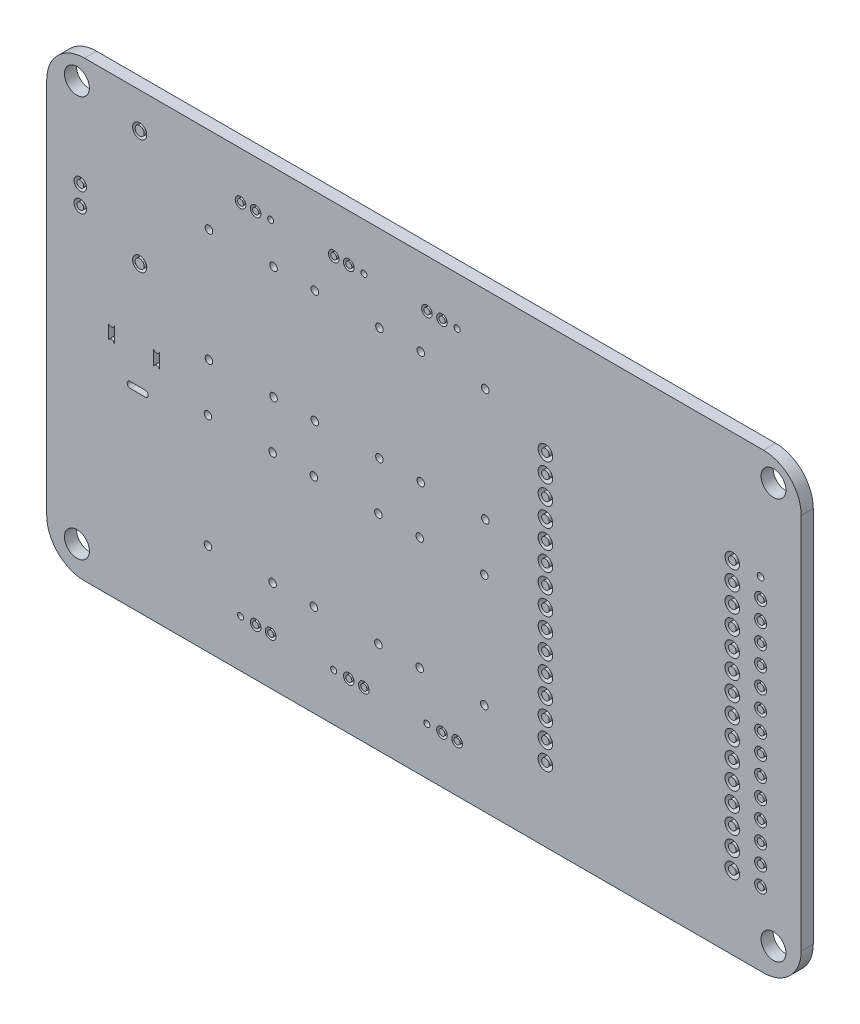
from build123d import *

# Parameters (mm, degrees)
BOSS_EXTRUDE2_DEPTH = 1.6
MULTI_LAYER_R       = 0.93980188
MULTI_LAYER_R_2     = 0.599441199
MULTI_LAYER_R_3     = 0.825501651
MULTI_LAYER_R_4     = 0.4500127
MULTI_LAYER_R_5     = 0.96520193
MULTI_LAYER_R_6     = 0.787401575
MULTI_LAYER_R_7     = 0.444500889
MULTI_LAYER_R_8     = 0.7
MULTI_LAYER_R_9     = 0.4
MULTI_LAYER_R_10    = 0.5
MULTI_LAYER_R_11    = 1.6500127
CUT_EXTRUDE2_DEPTH  = 1.6


with BuildPart() as part:
    # BoardOutLine → Boss-Extrude2 (new body)
    with BuildSketch(Plane.XY):
        with BuildLine():
            Line((0, -55), (0, -5))
            ThreePointArc((0, -5), (1.464466094, -1.464466094), (5, 0))
            Line((5, 0), (95, 0))
            ThreePointArc((95, 0), (98.535533906, -1.464466094), (100, -5))
            Line((100, -5), (100, -55))
            ThreePointArc((100, -55), (98.535533906, -58.535533906), (95, -60))
            Line((95, -60), (5, -60))
            ThreePointArc((5, -60), (1.464466094, -58.535533906), (0, -55))
        make_face()
    extrude(amount=BOSS_EXTRUDE2_DEPTH)

    # Multi-Layer → Cut-Extrude2 (cut)
    # profile 1 of 98: a face of its own
    with BuildSketch(Plane.XY.offset(1.6)):
        with Locations((12.319024638, -4.699009398)):
            Circle(MULTI_LAYER_R)
        with Locations((12.319024638, -4.699009398)):
            Circle(MULTI_LAYER_R_2, mode=Mode.SUBTRACT)
    # profile 2 of 98: a face of its own
    with BuildSketch(Plane.XY.offset(1.6)):
        with Locations((12.319024638, -19.939039878)):
            Circle(MULTI_LAYER_R)
        with Locations((12.319024638, -19.939039878)):
            Circle(MULTI_LAYER_R_2, mode=Mode.SUBTRACT)
    # profile 3 of 98: a face of its own
    with BuildSketch(Plane.XY.offset(1.6)):
        with Locations((4.44500889, -14.732029464)):
            Circle(MULTI_LAYER_R_3)
        with Locations((4.44500889, -14.732029464)):
            Circle(MULTI_LAYER_R_4, mode=Mode.SUBTRACT)
    # profile 4 of 98: a face of its own
    with BuildSketch(Plane.XY.offset(1.6)):
        with Locations((4.44500889, -17.272034544)):
            Circle(MULTI_LAYER_R_3)
        with Locations((4.44500889, -17.272034544)):
            Circle(MULTI_LAYER_R_4, mode=Mode.SUBTRACT)
    # profile 5 of 98: a face of its own
    with BuildSketch(Plane.XY.offset(1.6)):
        with Locations((90.864109728, -50.308356617)):
            Circle(MULTI_LAYER_R_5)
        with BuildLine():
            ThreePointArc((90.364109728, -50.308102616), (90.863982728, -50.808229616), (91.363855728, -50.308102616))
            ThreePointArc((91.363855728, -50.308102616), (90.863982728, -49.808229616), (90.364109728, -50.308102616))
        make_face(mode=Mode.SUBTRACT)
    # profile 6 of 98: a face of its own
    with BuildSketch(Plane.XY.offset(1.6)):
        with Locations((90.864109728, -47.768351537)):
            Circle(MULTI_LAYER_R_5)
        with BuildLine():
            ThreePointArc((90.364109728, -47.768097536), (90.863982728, -48.268224536), (91.363855728, -47.768097536))
            ThreePointArc((91.363855728, -47.768097536), (90.863982728, -47.268224536), (90.364109728, -47.768097536))
        make_face(mode=Mode.SUBTRACT)
    # profile 7 of 98: a face of its own
    with BuildSketch(Plane.XY.offset(1.6)):
        with Locations((90.864109728, -45.228346457)):
            Circle(MULTI_LAYER_R_5)
        with BuildLine():
            ThreePointArc((90.364109728, -45.228092456), (90.863982728, -45.728219456), (91.363855728, -45.228092456))
            ThreePointArc((91.363855728, -45.228092456), (90.863982728, -44.728219456), (90.364109728, -45.228092456))
        make_face(mode=Mode.SUBTRACT)
    # profile 8 of 98: a face of its own
    with BuildSketch(Plane.XY.offset(1.6)):
        with Locations((90.864109728, -42.688341377)):
            Circle(MULTI_LAYER_R_5)
        with BuildLine():
            ThreePointArc((90.364109728, -42.688087376), (90.863982728, -43.188214376), (91.363855728, -42.688087376))
            ThreePointArc((91.363855728, -42.688087376), (90.863982728, -42.188214376), (90.364109728, -42.688087376))
        make_face(mode=Mode.SUBTRACT)
    # profile 9 of 98: a face of its own
    with BuildSketch(Plane.XY.offset(1.6)):
        with Locations((90.864109728, -40.148336297)):
            Circle(MULTI_LAYER_R_5)
        with BuildLine():
            ThreePointArc((90.364109728, -40.148082296), (90.863982728, -40.648209296), (91.363855728, -40.148082296))
            ThreePointArc((91.363855728, -40.148082296), (90.863982728, -39.648209296), (90.364109728, -40.148082296))
        make_face(mode=Mode.SUBTRACT)
    # profile 10 of 98: a face of its own
    with BuildSketch(Plane.XY.offset(1.6)):
        with Locations((90.864109728, -37.608331217)):
            Circle(MULTI_LAYER_R_5)
        with BuildLine():
            ThreePointArc((90.364109728, -37.608077216), (90.863982728, -38.108204216), (91.363855728, -37.608077216))
            ThreePointArc((91.363855728, -37.608077216), (90.863982728, -37.108204216), (90.364109728, -37.608077216))
        make_face(mode=Mode.SUBTRACT)
    # profile 11 of 98: a face of its own
    with BuildSketch(Plane.XY.offset(1.6)):
        with Locations((90.864109728, -35.068326137)):
            Circle(MULTI_LAYER_R_5)
        with BuildLine():
            ThreePointArc((90.364109728, -35.068072136), (90.863982728, -35.568199136), (91.363855728, -35.068072136))
            ThreePointArc((91.363855728, -35.068072136), (90.863982728, -34.568199136), (90.364109728, -35.068072136))
        make_face(mode=Mode.SUBTRACT)
    # profile 12 of 98: a face of its own
    with BuildSketch(Plane.XY.offset(1.6)):
        with Locations((90.864109728, -32.528321057)):
            Circle(MULTI_LAYER_R_5)
        with BuildLine():
            ThreePointArc((90.364109728, -32.528067056), (90.863982728, -33.028194056), (91.363855728, -32.528067056))
            ThreePointArc((91.363855728, -32.528067056), (90.863982728, -32.028194056), (90.364109728, -32.528067056))
        make_face(mode=Mode.SUBTRACT)
    # profile 13 of 98: a face of its own
    with BuildSketch(Plane.XY.offset(1.6)):
        with Locations((90.864109728, -29.988315977)):
            Circle(MULTI_LAYER_R_5)
        with BuildLine():
            ThreePointArc((90.364109728, -29.988061976), (90.863982728, -30.488188976), (91.363855728, -29.988061976))
            ThreePointArc((91.363855728, -29.988061976), (90.863982728, -29.488188976), (90.364109728, -29.988061976))
        make_face(mode=Mode.SUBTRACT)
    # profile 14 of 98: a face of its own
    with BuildSketch(Plane.XY.offset(1.6)):
        with Locations((90.864109728, -27.448310897)):
            Circle(MULTI_LAYER_R_5)
        with BuildLine():
            ThreePointArc((90.364109728, -27.448056896), (90.863982728, -27.948183896), (91.363855728, -27.448056896))
            ThreePointArc((91.363855728, -27.448056896), (90.863982728, -26.948183896), (90.364109728, -27.448056896))
        make_face(mode=Mode.SUBTRACT)
    # profile 15 of 98: a face of its own
    with BuildSketch(Plane.XY.offset(1.6)):
        with Locations((90.864109728, -24.908305817)):
            Circle(MULTI_LAYER_R_5)
        with BuildLine():
            ThreePointArc((90.364109728, -24.908051816), (90.863982728, -25.408178816), (91.363855728, -24.908051816))
            ThreePointArc((91.363855728, -24.908051816), (90.863982728, -24.408178816), (90.364109728, -24.908051816))
        make_face(mode=Mode.SUBTRACT)
    # profile 16 of 98: a face of its own
    with BuildSketch(Plane.XY.offset(1.6)):
        with Locations((90.864109728, -22.368300737)):
            Circle(MULTI_LAYER_R_5)
        with BuildLine():
            ThreePointArc((90.364109728, -22.368046736), (90.863982728, -22.868173736), (91.363855728, -22.368046736))
            ThreePointArc((91.363855728, -22.368046736), (90.863982728, -21.868173736), (90.364109728, -22.368046736))
        make_face(mode=Mode.SUBTRACT)
    # profile 17 of 98: a face of its own
    with BuildSketch(Plane.XY.offset(1.6)):
        with Locations((90.864109728, -19.828295657)):
            Circle(MULTI_LAYER_R_5)
        with BuildLine():
            ThreePointArc((90.364109728, -19.828041656), (90.863982728, -20.328168656), (91.363855728, -19.828041656))
            ThreePointArc((91.363855728, -19.828041656), (90.863982728, -19.328168656), (90.364109728, -19.828041656))
        make_face(mode=Mode.SUBTRACT)
    # profile 18 of 98: a face of its own
    with BuildSketch(Plane.XY.offset(1.6)):
        with Locations((90.864109728, -17.288290577)):
            Circle(MULTI_LAYER_R_5)
        with BuildLine():
            ThreePointArc((90.364109728, -17.288036576), (90.863982728, -17.788163576), (91.363855728, -17.288036576))
            ThreePointArc((91.363855728, -17.288036576), (90.863982728, -16.788163576), (90.364109728, -17.288036576))
        make_face(mode=Mode.SUBTRACT)
    # profile 19 of 98: a face of its own
    with BuildSketch(Plane.XY.offset(1.6)):
        with Locations((90.864109728, -14.748285497)):
            Circle(MULTI_LAYER_R_5)
        with BuildLine():
            ThreePointArc((90.364109728, -14.748031496), (90.863982728, -15.248158496), (91.363855728, -14.748031496))
            ThreePointArc((91.363855728, -14.748031496), (90.863982728, -14.248158496), (90.364109728, -14.748031496))
        make_face(mode=Mode.SUBTRACT)
    # profile 20 of 98: a face of its own
    with BuildSketch(Plane.XY.offset(1.6)):
        with Locations((66.093980188, -14.748285497)):
            Circle(MULTI_LAYER_R_5)
        with BuildLine():
            ThreePointArc((65.593980188, -14.748031496), (66.093853188, -15.248158496), (66.593726187, -14.748031496))
            ThreePointArc((66.593726187, -14.748031496), (66.093853188, -14.248158496), (65.593980188, -14.748031496))
        make_face(mode=Mode.SUBTRACT)
    # profile 21 of 98: a face of its own
    with BuildSketch(Plane.XY.offset(1.6)):
        with Locations((66.093980188, -17.288290577)):
            Circle(MULTI_LAYER_R_5)
        with BuildLine():
            ThreePointArc((65.593980188, -17.288036576), (66.093853188, -17.788163576), (66.593726187, -17.288036576))
            ThreePointArc((66.593726187, -17.288036576), (66.093853188, -16.788163576), (65.593980188, -17.288036576))
        make_face(mode=Mode.SUBTRACT)
    # profile 22 of 98: a face of its own
    with BuildSketch(Plane.XY.offset(1.6)):
        with Locations((66.093980188, -19.828295657)):
            Circle(MULTI_LAYER_R_5)
        with BuildLine():
            ThreePointArc((65.593980188, -19.828041656), (66.093853188, -20.328168656), (66.593726187, -19.828041656))
            ThreePointArc((66.593726187, -19.828041656), (66.093853188, -19.328168656), (65.593980188, -19.828041656))
        make_face(mode=Mode.SUBTRACT)
    # profile 23 of 98: a face of its own
    with BuildSketch(Plane.XY.offset(1.6)):
        with Locations((66.093980188, -22.368300737)):
            Circle(MULTI_LAYER_R_5)
        with BuildLine():
            ThreePointArc((65.593980188, -22.368046736), (66.093853188, -22.868173736), (66.593726187, -22.368046736))
            ThreePointArc((66.593726187, -22.368046736), (66.093853188, -21.868173736), (65.593980188, -22.368046736))
        make_face(mode=Mode.SUBTRACT)
    # profile 24 of 98: a face of its own
    with BuildSketch(Plane.XY.offset(1.6)):
        with Locations((66.093980188, -24.908305817)):
            Circle(MULTI_LAYER_R_5)
        with BuildLine():
            ThreePointArc((65.593980188, -24.908051816), (66.093853188, -25.408178816), (66.593726187, -24.908051816))
            ThreePointArc((66.593726187, -24.908051816), (66.093853188, -24.408178816), (65.593980188, -24.908051816))
        make_face(mode=Mode.SUBTRACT)
    # profile 25 of 98: a face of its own
    with BuildSketch(Plane.XY.offset(1.6)):
        with Locations((66.093980188, -27.448310897)):
            Circle(MULTI_LAYER_R_5)
        with BuildLine():
            ThreePointArc((65.593980188, -27.448056896), (66.093853188, -27.948183896), (66.593726187, -27.448056896))
            ThreePointArc((66.593726187, -27.448056896), (66.093853188, -26.948183896), (65.593980188, -27.448056896))
        make_face(mode=Mode.SUBTRACT)
    # profile 26 of 98: a face of its own
    with BuildSketch(Plane.XY.offset(1.6)):
        with Locations((66.093980188, -29.988315977)):
            Circle(MULTI_LAYER_R_5)
        with BuildLine():
            ThreePointArc((65.593980188, -29.988061976), (66.093853188, -30.488188976), (66.593726187, -29.988061976))
            ThreePointArc((66.593726187, -29.988061976), (66.093853188, -29.488188976), (65.593980188, -29.988061976))
        make_face(mode=Mode.SUBTRACT)
    # profile 27 of 98: a face of its own
    with BuildSketch(Plane.XY.offset(1.6)):
        with Locations((66.093980188, -32.528321057)):
            Circle(MULTI_LAYER_R_5)
        with BuildLine():
            ThreePointArc((65.593980188, -32.528067056), (66.093853188, -33.028194056), (66.593726187, -32.528067056))
            ThreePointArc((66.593726187, -32.528067056), (66.093853188, -32.028194056), (65.593980188, -32.528067056))
        make_face(mode=Mode.SUBTRACT)
    # profile 28 of 98: a face of its own
    with BuildSketch(Plane.XY.offset(1.6)):
        with Locations((66.093980188, -35.068326137)):
            Circle(MULTI_LAYER_R_5)
        with BuildLine():
            ThreePointArc((65.593980188, -35.068072136), (66.093853188, -35.568199136), (66.593726187, -35.068072136))
            ThreePointArc((66.593726187, -35.068072136), (66.093853188, -34.568199136), (65.593980188, -35.068072136))
        make_face(mode=Mode.SUBTRACT)
    # profile 29 of 98: a face of its own
    with BuildSketch(Plane.XY.offset(1.6)):
        with Locations((66.093980188, -37.608331217)):
            Circle(MULTI_LAYER_R_5)
        with BuildLine():
            ThreePointArc((65.593980188, -37.608077216), (66.093853188, -38.108204216), (66.593726187, -37.608077216))
            ThreePointArc((66.593726187, -37.608077216), (66.093853188, -37.108204216), (65.593980188, -37.608077216))
        make_face(mode=Mode.SUBTRACT)
    # profile 30 of 98: a face of its own
    with BuildSketch(Plane.XY.offset(1.6)):
        with Locations((66.093980188, -40.148336297)):
            Circle(MULTI_LAYER_R_5)
        with BuildLine():
            ThreePointArc((65.593980188, -40.148082296), (66.093853188, -40.648209296), (66.593726187, -40.148082296))
            ThreePointArc((66.593726187, -40.148082296), (66.093853188, -39.648209296), (65.593980188, -40.148082296))
        make_face(mode=Mode.SUBTRACT)
    # profile 31 of 98: a face of its own
    with BuildSketch(Plane.XY.offset(1.6)):
        with Locations((66.093980188, -42.688341377)):
            Circle(MULTI_LAYER_R_5)
        with BuildLine():
            ThreePointArc((65.593980188, -42.688087376), (66.093853188, -43.188214376), (66.593726187, -42.688087376))
            ThreePointArc((66.593726187, -42.688087376), (66.093853188, -42.188214376), (65.593980188, -42.688087376))
        make_face(mode=Mode.SUBTRACT)
    # profile 32 of 98: a face of its own
    with BuildSketch(Plane.XY.offset(1.6)):
        with Locations((66.093980188, -45.228346457)):
            Circle(MULTI_LAYER_R_5)
        with BuildLine():
            ThreePointArc((65.593980188, -45.228092456), (66.093853188, -45.728219456), (66.593726187, -45.228092456))
            ThreePointArc((66.593726187, -45.228092456), (66.093853188, -44.728219456), (65.593980188, -45.228092456))
        make_face(mode=Mode.SUBTRACT)
    # profile 33 of 98: a face of its own
    with BuildSketch(Plane.XY.offset(1.6)):
        with Locations((66.093980188, -47.768351537)):
            Circle(MULTI_LAYER_R_5)
        with BuildLine():
            ThreePointArc((65.593980188, -47.768097536), (66.093853188, -48.268224536), (66.593726187, -47.768097536))
            ThreePointArc((66.593726187, -47.768097536), (66.093853188, -47.268224536), (65.593980188, -47.768097536))
        make_face(mode=Mode.SUBTRACT)
    # profile 34 of 98: a face of its own
    with BuildSketch(Plane.XY.offset(1.6)):
        with Locations((66.093980188, -50.308356617)):
            Circle(MULTI_LAYER_R_5)
        with BuildLine():
            ThreePointArc((65.593980188, -50.308102616), (66.093853188, -50.808229616), (66.593726187, -50.308102616))
            ThreePointArc((66.593726187, -50.308102616), (66.093853188, -49.808229616), (65.593980188, -50.308102616))
        make_face(mode=Mode.SUBTRACT)
    # profile 35 of 98: a face of its own
    with BuildSketch(Plane.XY.offset(1.6)):
        with Locations((94.61518923, -50.292100584)):
            Circle(MULTI_LAYER_R_6)
        with Locations((94.61518923, -50.292100584)):
            Circle(MULTI_LAYER_R_7, mode=Mode.SUBTRACT)
    # profile 36 of 98: a face of its own
    with BuildSketch(Plane.XY.offset(1.6)):
        with Locations((94.61518923, -47.752095504)):
            Circle(MULTI_LAYER_R_6)
        with Locations((94.61518923, -47.752095504)):
            Circle(MULTI_LAYER_R_7, mode=Mode.SUBTRACT)
    # profile 37 of 98: a face of its own
    with BuildSketch(Plane.XY.offset(1.6)):
        with Locations((94.61518923, -45.212090424)):
            Circle(MULTI_LAYER_R_6)
        with Locations((94.61518923, -45.212090424)):
            Circle(MULTI_LAYER_R_7, mode=Mode.SUBTRACT)
    # profile 38 of 98: a face of its own
    with BuildSketch(Plane.XY.offset(1.6)):
        with Locations((94.61518923, -42.672085344)):
            Circle(MULTI_LAYER_R_6)
        with Locations((94.61518923, -42.672085344)):
            Circle(MULTI_LAYER_R_7, mode=Mode.SUBTRACT)
    # profile 39 of 98: a face of its own
    with BuildSketch(Plane.XY.offset(1.6)):
        with Locations((94.61518923, -40.132080264)):
            Circle(MULTI_LAYER_R_6)
        with Locations((94.61518923, -40.132080264)):
            Circle(MULTI_LAYER_R_7, mode=Mode.SUBTRACT)
    # profile 40 of 98: a face of its own
    with BuildSketch(Plane.XY.offset(1.6)):
        with Locations((94.61518923, -37.592075184)):
            Circle(MULTI_LAYER_R_6)
        with Locations((94.61518923, -37.592075184)):
            Circle(MULTI_LAYER_R_7, mode=Mode.SUBTRACT)
    # profile 41 of 98: a face of its own
    with BuildSketch(Plane.XY.offset(1.6)):
        with Locations((94.61518923, -35.052070104)):
            Circle(MULTI_LAYER_R_6)
        with Locations((94.61518923, -35.052070104)):
            Circle(MULTI_LAYER_R_7, mode=Mode.SUBTRACT)
    # profile 42 of 98: a face of its own
    with BuildSketch(Plane.XY.offset(1.6)):
        with Locations((94.61518923, -32.512065024)):
            Circle(MULTI_LAYER_R_6)
        with Locations((94.61518923, -32.512065024)):
            Circle(MULTI_LAYER_R_7, mode=Mode.SUBTRACT)
    # profile 43 of 98: a face of its own
    with BuildSketch(Plane.XY.offset(1.6)):
        with Locations((94.61518923, -29.972059944)):
            Circle(MULTI_LAYER_R_6)
        with Locations((94.61518923, -29.972059944)):
            Circle(MULTI_LAYER_R_7, mode=Mode.SUBTRACT)
    # profile 44 of 98: a face of its own
    with BuildSketch(Plane.XY.offset(1.6)):
        with Locations((94.61518923, -27.432054864)):
            Circle(MULTI_LAYER_R_6)
        with Locations((94.61518923, -27.432054864)):
            Circle(MULTI_LAYER_R_7, mode=Mode.SUBTRACT)
    # profile 45 of 98: a face of its own
    with BuildSketch(Plane.XY.offset(1.6)):
        with Locations((94.61518923, -24.892049784)):
            Circle(MULTI_LAYER_R_6)
        with Locations((94.61518923, -24.892049784)):
            Circle(MULTI_LAYER_R_7, mode=Mode.SUBTRACT)
    # profile 46 of 98: a face of its own
    with BuildSketch(Plane.XY.offset(1.6)):
        with Locations((94.61518923, -22.352044704)):
            Circle(MULTI_LAYER_R_6)
        with Locations((94.61518923, -22.352044704)):
            Circle(MULTI_LAYER_R_7, mode=Mode.SUBTRACT)
    # profile 47 of 98: a face of its own
    with BuildSketch(Plane.XY.offset(1.6)):
        with Locations((94.61518923, -19.812039624)):
            Circle(MULTI_LAYER_R_6)
        with Locations((94.61518923, -19.812039624)):
            Circle(MULTI_LAYER_R_7, mode=Mode.SUBTRACT)
    # profile 48 of 98: a face of its own
    with BuildSketch(Plane.XY.offset(1.6)):
        with Locations((94.61518923, -17.272034544)):
            Circle(MULTI_LAYER_R_6)
        with Locations((94.61518923, -17.272034544)):
            Circle(MULTI_LAYER_R_7, mode=Mode.SUBTRACT)
    # profile 49 of 98: a face of its own
    with BuildSketch(Plane.XY.offset(1.6)):
        with Locations((40.036830074, -6.223012446)):
            Circle(MULTI_LAYER_R_8)
        with Locations((40.036830074, -6.223012446)):
            Circle(MULTI_LAYER_R_9, mode=Mode.SUBTRACT)
    # profile 50 of 98: a face of its own
    with BuildSketch(Plane.XY.offset(1.6)):
        with Locations((38.036830074, -6.223012446)):
            Circle(MULTI_LAYER_R_8)
        with Locations((38.036830074, -6.223012446)):
            Circle(MULTI_LAYER_R_9, mode=Mode.SUBTRACT)
    # profile 51 of 98: a face of its own
    with BuildSketch(Plane.XY.offset(1.6)):
        with Locations((52.387604775, -6.3500127)):
            Circle(MULTI_LAYER_R_8)
        with Locations((52.387604775, -6.3500127)):
            Circle(MULTI_LAYER_R_9, mode=Mode.SUBTRACT)
    # profile 52 of 98: a face of its own
    with BuildSketch(Plane.XY.offset(1.6)):
        with Locations((50.387604775, -6.3500127)):
            Circle(MULTI_LAYER_R_8)
        with Locations((50.387604775, -6.3500127)):
            Circle(MULTI_LAYER_R_9, mode=Mode.SUBTRACT)
    # profile 53 of 98: a face of its own
    with BuildSketch(Plane.XY.offset(1.6)):
        with Locations((40.036830074, -53.721107442)):
            Circle(MULTI_LAYER_R_8)
        with Locations((40.036830074, -53.721107442)):
            Circle(MULTI_LAYER_R_9, mode=Mode.SUBTRACT)
    # profile 54 of 98: a face of its own
    with BuildSketch(Plane.XY.offset(1.6)):
        with Locations((42.036830074, -53.721107442)):
            Circle(MULTI_LAYER_R_8)
        with Locations((42.036830074, -53.721107442)):
            Circle(MULTI_LAYER_R_9, mode=Mode.SUBTRACT)
    # profile 55 of 98: a face of its own
    with BuildSketch(Plane.XY.offset(1.6)):
        with Locations((52.387604775, -53.721107442)):
            Circle(MULTI_LAYER_R_8)
        with Locations((52.387604775, -53.721107442)):
            Circle(MULTI_LAYER_R_9, mode=Mode.SUBTRACT)
    # profile 56 of 98: a face of its own
    with BuildSketch(Plane.XY.offset(1.6)):
        with Locations((54.387604775, -53.721107442)):
            Circle(MULTI_LAYER_R_8)
        with Locations((54.387604775, -53.721107442)):
            Circle(MULTI_LAYER_R_9, mode=Mode.SUBTRACT)
    # profile 57 of 98: a face of its own
    with BuildSketch(Plane.XY.offset(1.6)):
        with Locations((27.686055372, -6.223012446)):
            Circle(MULTI_LAYER_R_8)
        with Locations((27.686055372, -6.223012446)):
            Circle(MULTI_LAYER_R_9, mode=Mode.SUBTRACT)
    # profile 58 of 98: a face of its own
    with BuildSketch(Plane.XY.offset(1.6)):
        with Locations((25.686055372, -6.223012446)):
            Circle(MULTI_LAYER_R_8)
        with Locations((25.686055372, -6.223012446)):
            Circle(MULTI_LAYER_R_9, mode=Mode.SUBTRACT)
    # profile 59 of 98: a face of its own
    with BuildSketch(Plane.XY.offset(1.6)):
        with Locations((27.686055372, -53.721107442)):
            Circle(MULTI_LAYER_R_8)
        with Locations((27.686055372, -53.721107442)):
            Circle(MULTI_LAYER_R_9, mode=Mode.SUBTRACT)
    # profile 60 of 98: a face of its own
    with BuildSketch(Plane.XY.offset(1.6)):
        with Locations((29.686055372, -53.721107442)):
            Circle(MULTI_LAYER_R_8)
        with Locations((29.686055372, -53.721107442)):
            Circle(MULTI_LAYER_R_9, mode=Mode.SUBTRACT)
    # profile 61 of 98: a face of its own
    with BuildSketch(Plane.XY.offset(1.6)):
        with Locations((44.096113792, -11.41490983)):
            Circle(MULTI_LAYER_R_10)
    # profile 62 of 98: a face of its own
    with BuildSketch(Plane.XY.offset(1.6)):
        with Locations((35.537312675, -11.41490983)):
            Circle(MULTI_LAYER_R_10)
    # profile 63 of 98: a face of its own
    with BuildSketch(Plane.XY.offset(1.6)):
        with Locations((44.096113792, -26.38016256)):
            Circle(MULTI_LAYER_R_10)
    # profile 64 of 98: a face of its own
    with BuildSketch(Plane.XY.offset(1.6)):
        with Locations((35.537312675, -26.38016256)):
            Circle(MULTI_LAYER_R_10)
    # profile 65 of 98: a face of its own
    with BuildSketch(Plane.XY.offset(1.6)):
        with Locations((58.129641859, -11.41490983)):
            Circle(MULTI_LAYER_R_10)
    # profile 66 of 98: a face of its own
    with BuildSketch(Plane.XY.offset(1.6)):
        with Locations((49.570840742, -11.41490983)):
            Circle(MULTI_LAYER_R_10)
    # profile 67 of 98: a face of its own
    with BuildSketch(Plane.XY.offset(1.6)):
        with Locations((58.129641859, -26.38016256)):
            Circle(MULTI_LAYER_R_10)
    # profile 68 of 98: a face of its own
    with BuildSketch(Plane.XY.offset(1.6)):
        with Locations((49.570840742, -26.38016256)):
            Circle(MULTI_LAYER_R_10)
    # profile 69 of 98: a face of its own
    with BuildSketch(Plane.XY.offset(1.6)):
        with Locations((30.062585725, -11.41490983)):
            Circle(MULTI_LAYER_R_10)
    # profile 70 of 98: a face of its own
    with BuildSketch(Plane.XY.offset(1.6)):
        with Locations((21.503784608, -11.41490983)):
            Circle(MULTI_LAYER_R_10)
    # profile 71 of 98: a face of its own
    with BuildSketch(Plane.XY.offset(1.6)):
        with Locations((30.062585725, -26.38016256)):
            Circle(MULTI_LAYER_R_10)
    # profile 72 of 98: a face of its own
    with BuildSketch(Plane.XY.offset(1.6)):
        with Locations((21.503784608, -26.38016256)):
            Circle(MULTI_LAYER_R_10)
    # profile 73 of 98: a face of its own
    with BuildSketch(Plane.XY.offset(1.6)):
        with Locations((49.439573279, -47.767208534)):
            Circle(MULTI_LAYER_R_10)
    # profile 74 of 98: a face of its own
    with BuildSketch(Plane.XY.offset(1.6)):
        with Locations((57.998374397, -47.767208534)):
            Circle(MULTI_LAYER_R_10)
    # profile 75 of 98: a face of its own
    with BuildSketch(Plane.XY.offset(1.6)):
        with Locations((49.439573279, -32.801955804)):
            Circle(MULTI_LAYER_R_10)
    # profile 76 of 98: a face of its own
    with BuildSketch(Plane.XY.offset(1.6)):
        with Locations((57.998374397, -32.801955804)):
            Circle(MULTI_LAYER_R_10)
    # profile 77 of 98: a face of its own
    with BuildSketch(Plane.XY.offset(1.6)):
        with Locations((35.406045212, -47.767208534)):
            Circle(MULTI_LAYER_R_10)
    # profile 78 of 98: a face of its own
    with BuildSketch(Plane.XY.offset(1.6)):
        with Locations((43.96484633, -47.767208534)):
            Circle(MULTI_LAYER_R_10)
    # profile 79 of 98: a face of its own
    with BuildSketch(Plane.XY.offset(1.6)):
        with Locations((35.406045212, -32.801955804)):
            Circle(MULTI_LAYER_R_10)
    # profile 80 of 98: a face of its own
    with BuildSketch(Plane.XY.offset(1.6)):
        with Locations((43.96484633, -32.801955804)):
            Circle(MULTI_LAYER_R_10)
    # profile 81 of 98: a face of its own
    with BuildSketch(Plane.XY.offset(1.6)):
        with Locations((21.372517145, -47.767208534)):
            Circle(MULTI_LAYER_R_10)
    # profile 82 of 98: a face of its own
    with BuildSketch(Plane.XY.offset(1.6)):
        with Locations((29.931318263, -47.767208534)):
            Circle(MULTI_LAYER_R_10)
    # profile 83 of 98: a face of its own
    with BuildSketch(Plane.XY.offset(1.6)):
        with Locations((21.372517145, -32.801955804)):
            Circle(MULTI_LAYER_R_10)
    # profile 84 of 98: a face of its own
    with BuildSketch(Plane.XY.offset(1.6)):
        with Locations((29.931318263, -32.801955804)):
            Circle(MULTI_LAYER_R_10)
    # profile 85 of 98: a face of its own
    with BuildSketch(Plane.XY.offset(1.6)):
        with Locations((94.61518923, -14.732029464)):
            Circle(MULTI_LAYER_R_7)
    # profile 86 of 98: a face of its own
    with BuildSketch(Plane.XY.offset(1.6)):
        with Locations((42.036830074, -6.223012446)):
            Circle(MULTI_LAYER_R_9)
    # profile 87 of 98: a face of its own
    with BuildSketch(Plane.XY.offset(1.6)):
        with Locations((54.387604775, -6.3500127)):
            Circle(MULTI_LAYER_R_9)
    # profile 88 of 98: a face of its own
    with BuildSketch(Plane.XY.offset(1.6)):
        with Locations((38.036830074, -53.721107442)):
            Circle(MULTI_LAYER_R_9)
    # profile 89 of 98: a face of its own
    with BuildSketch(Plane.XY.offset(1.6)):
        with Locations((50.387604775, -53.721107442)):
            Circle(MULTI_LAYER_R_9)
    # profile 90 of 98: a face of its own
    with BuildSketch(Plane.XY.offset(1.6)):
        with Locations((29.686055372, -6.223012446)):
            Circle(MULTI_LAYER_R_9)
    # profile 91 of 98: a face of its own
    with BuildSketch(Plane.XY.offset(1.6)):
        with Locations((25.686055372, -53.721107442)):
            Circle(MULTI_LAYER_R_9)
    # profile 92 of 98: a face of its own
    with BuildSketch(Plane.XY.offset(1.6)):
        with Locations((96.329692659, -3.111506223)):
            Circle(MULTI_LAYER_R_11)
    # profile 93 of 98: a face of its own
    with BuildSketch(Plane.XY.offset(1.6)):
        with Locations((4.000508001, -3.111506223)):
            Circle(MULTI_LAYER_R_11)
    # profile 94 of 98: a face of its own
    with BuildSketch(Plane.XY.offset(1.6)):
        with Locations((96.329692659, -56.261112522)):
            Circle(MULTI_LAYER_R_11)
    # profile 95 of 98: a face of its own
    with BuildSketch(Plane.XY.offset(1.6)):
        with Locations((4.000508001, -56.261112522)):
            Circle(MULTI_LAYER_R_11)
    # profile 96 of 98: a face of its own
    with BuildSketch(Plane.XY.offset(1.6)):
        with BuildLine():
            Line((13.057200914, -34.081203962), (11.057200914, -34.081203962))
            ThreePointArc((11.057200914, -34.081203962), (10.657200914, -34.481203962), (11.057200914, -34.881203962))
            Line((11.057200914, -34.881203962), (13.057200914, -34.881203962))
            ThreePointArc((13.057200914, -34.881203962), (13.457200914, -34.481203962), (13.057200914, -34.081203962))
        make_face()
    # profile 97 of 98: a face of its own
    with BuildSketch(Plane.XY.offset(1.6)):
        with BuildLine():
            Line((8.157099314, -30.880924562), (8.157099314, -28.680924562))
            ThreePointArc((8.157099314, -28.680924562), (8.557099314, -29.080924562), (8.957099314, -28.680924562))
            Line((8.957099314, -28.680924562), (8.957099314, -30.880924562))
            ThreePointArc((8.957099314, -30.880924562), (8.557099314, -30.480924562), (8.157099314, -30.880924562))
        make_face()
    # profile 98 of 98: a face of its own
    with BuildSketch(Plane.XY.offset(1.6)):
        with BuildLine():
            Line((14.156819914, -28.681051562), (14.156819914, -30.881051562))
            ThreePointArc((14.156819914, -30.881051562), (14.556819914, -30.481051562), (14.956819914, -30.881051562))
            Line((14.956819914, -30.881051562), (14.956819914, -28.681051562))
            ThreePointArc((14.956819914, -28.681051562), (14.556819914, -29.081051562), (14.156819914, -28.681051562))
        make_face()
    extrude(amount=-CUT_EXTRUDE2_DEPTH, mode=Mode.SUBTRACT)


solid = part.part
